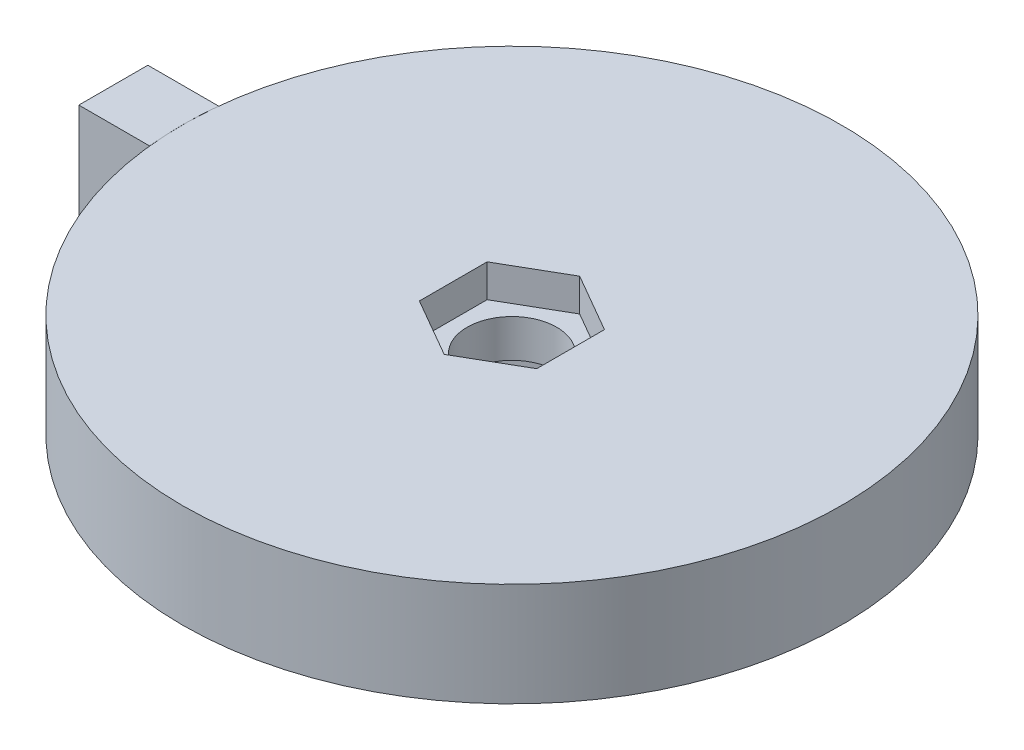
from build123d import *

# Parameters (mm, degrees)
ESQUISSE1_R             = 47.75
BOSS_EXTRU_1_DEPTH      = 15
BOSS_EXTRU_2_DEPTH      = 15
ESQUISSE3_R             = 6.5
ENL_V_MAT_EXTRU_1_DEPTH = 77.420710544
ENL_V_MAT_EXTRU_3_DEPTH = 4.75
ENL_V_MAT_EXTRU_4_DEPTH = 4.75


with BuildPart() as part:
    # Esquisse1 → Boss.-Extru.1 (new body)
    with BuildSketch(Plane(origin=(0, 0, 0), x_dir=(1, 0, 0), z_dir=(0, 1, 0))):
        with Locations(Location((0, 0, 0), (0, 0, 270))):
            Circle(ESQUISSE1_R)
    extrude(amount=BOSS_EXTRU_1_DEPTH)

    # Esquisse3 → Enlèv. mat.-Extru.1 (cut, through all)
    with BuildSketch(Plane(origin=(0, 15, 0), x_dir=(1, 0, 0), z_dir=(0, 1, 0))):
        with Locations(Location((0, 0, 0), (0, 0, 270))):
            Circle(ESQUISSE3_R)
    extrude(amount=-ENL_V_MAT_EXTRU_1_DEPTH, mode=Mode.SUBTRACT)

    # Esquisse4 → Enlèv. mat.-Extru.3 (cut)
    with BuildSketch(Plane(origin=(0, 15, 0), x_dir=(1, 0, 0), z_dir=(0, 1, 0))):
        Polygon((4.25, 7.361215932), (0, 9.814954576), (-4.25, 7.361215932), (-8.5, 4.907477288), (-8.5, 0), (-8.5, -4.907477288), (-4.25, -7.361215932), (0, -9.814954576), (4.25, -7.361215932), (8.5, -4.907477288), (8.5, 0), (8.5, 4.907477288), align=None)
    extrude(amount=-ENL_V_MAT_EXTRU_3_DEPTH, mode=Mode.SUBTRACT)

    # Esquisse5 → Enlèv. mat.-Extru.4 (cut)
    with BuildSketch(Plane.XZ):
        Polygon((-8.5, 4.907477288), (0, 9.814954576), (8.5, 4.907477288), (8.5, -4.907477288), (0, -9.814954576), (-8.5, -4.907477288), align=None)
    extrude(amount=-ENL_V_MAT_EXTRU_4_DEPTH, mode=Mode.SUBTRACT)


with BuildPart() as body_2:
    # Esquisse2 → Boss.-Extru.2 (new body)
    with BuildSketch(Plane.XZ):
        with BuildLine():
            ThreePointArc((-47.487498355, -5), (-47.68432943, -2.503442985), (-47.75, 0))
            Line((-47.75, 0), (-57.75, 0))
            Line((-57.75, 0), (-57.75, -5))
            Line((-57.75, -5), (-47.487498355, -5))
        make_face()
        with BuildLine():
            Line((-57.75, 0), (-47.75, 0))
            ThreePointArc((-47.75, 0), (-47.68432943, 2.503442985), (-47.487498355, 5))
            Line((-47.487498355, 5), (-57.75, 5))
            Line((-57.75, 5), (-57.75, 0))
        make_face()
    extrude(amount=-BOSS_EXTRU_2_DEPTH)


solid = Compound([part.part, body_2.part])
